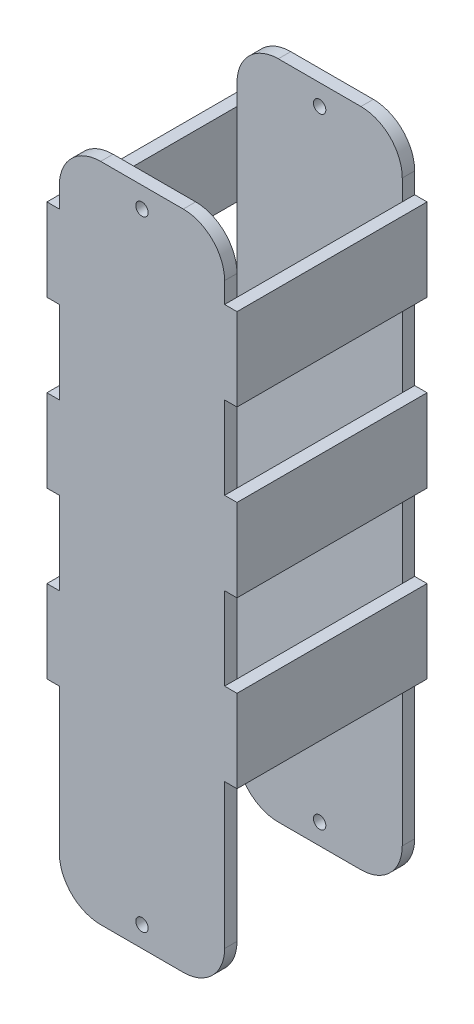
from build123d import *

# Parameters (mm, degrees)
BOSS_EXTRUDE1_START     = 40
BOSS_EXTRUDE1_DEPTH     = 3
BOSS_EXTRUDE2_DEPTH     = 3
CUT_EXTRUDE1_DEPTH      = 94
CUT_EXTRUDE1_DEPTH_BACK = 94
SKETCH2_R               = 1.5
SKETCH3_W               = 46
SKETCH3_H               = 20
BOSS_EXTRUDE4_DEPTH     = 3


with BuildPart() as part:
    # Sketch1 → Boss-Extrude1 (new body)
    with BuildSketch(Plane.XY.offset(BOSS_EXTRUDE1_START)):
        with BuildLine():
            Line((-10, 80), (10, 80))
            ThreePointArc((10, 80), (17.071067812, 77.071067812), (20, 70))
            Line((20, 70), (20, -70))
            ThreePointArc((20, -70), (17.071067812, -77.071067812), (10, -80))
            Line((10, -80), (-10, -80))
            ThreePointArc((-10, -80), (-17.071067812, -77.071067812), (-20, -70))
            Line((-20, -70), (-20, 70))
            ThreePointArc((-20, 70), (-17.071067812, 77.071067812), (-10, 80))
        make_face()
    extrude(amount=BOSS_EXTRUDE1_DEPTH)


with BuildPart() as body_2:
    # Sketch1<3> → Boss-Extrude2 (new body)
    with BuildSketch(Plane.XY):
        with BuildLine():
            Line((-10, 80), (10, 80))
            ThreePointArc((10, 80), (17.071067812, 77.071067812), (20, 70))
            Line((20, 70), (20, -70))
            ThreePointArc((20, -70), (17.071067812, -77.071067812), (10, -80))
            Line((10, -80), (-10, -80))
            ThreePointArc((-10, -80), (-17.071067812, -77.071067812), (-20, -70))
            Line((-20, -70), (-20, 70))
            ThreePointArc((-20, 70), (-17.071067812, 77.071067812), (-10, 80))
        make_face()
    extrude(amount=-BOSS_EXTRUDE2_DEPTH)


with BuildPart() as cut_extrude1_tool:
    # Sketch2 → Cut-Extrude1 (new, two sides: drawn at the far end of the back side and taken through both)
    with BuildSketch(Plane.XY.offset(-CUT_EXTRUDE1_DEPTH_BACK)):
        with Locations((0, 75)):
            Circle(SKETCH2_R)
        with Locations((0, -75)):
            Circle(SKETCH2_R)
    extrude(amount=CUT_EXTRUDE1_DEPTH + CUT_EXTRUDE1_DEPTH_BACK)


with BuildPart() as part_1:
    add(part.part)

    # Cut-Extrude1: cut by cut_extrude1_tool
    add(cut_extrude1_tool.part, mode=Mode.SUBTRACT)



with BuildPart() as body_2_1:
    add(body_2.part)

    # Cut-Extrude1: cut by cut_extrude1_tool
    add(cut_extrude1_tool.part, mode=Mode.SUBTRACT)


with BuildPart() as part_2:
    add(part_1.part)

    add(body_2_1.part)  # Boss-Extrude4 merges body 2
    # Sketch3 → Boss-Extrude4 (add)
    with BuildSketch(Plane.ZY.offset(20)):
        with Locations((20, 55)):
            Rectangle(SKETCH3_W, SKETCH3_H)
        with Locations((20, 15)):
            Rectangle(SKETCH3_W, SKETCH3_H)
        with Locations((20, -25)):
            Rectangle(SKETCH3_W, SKETCH3_H)
    boss_extrude4 = extrude(amount=BOSS_EXTRUDE4_DEPTH)

    # Mirror1: Boss-Extrude4 across plane
    add(boss_extrude4.mirror(Plane(origin=(0, 0, 0), x_dir=(0, 0, 1), z_dir=(1, 0, 0))))


solid = part_2.part
